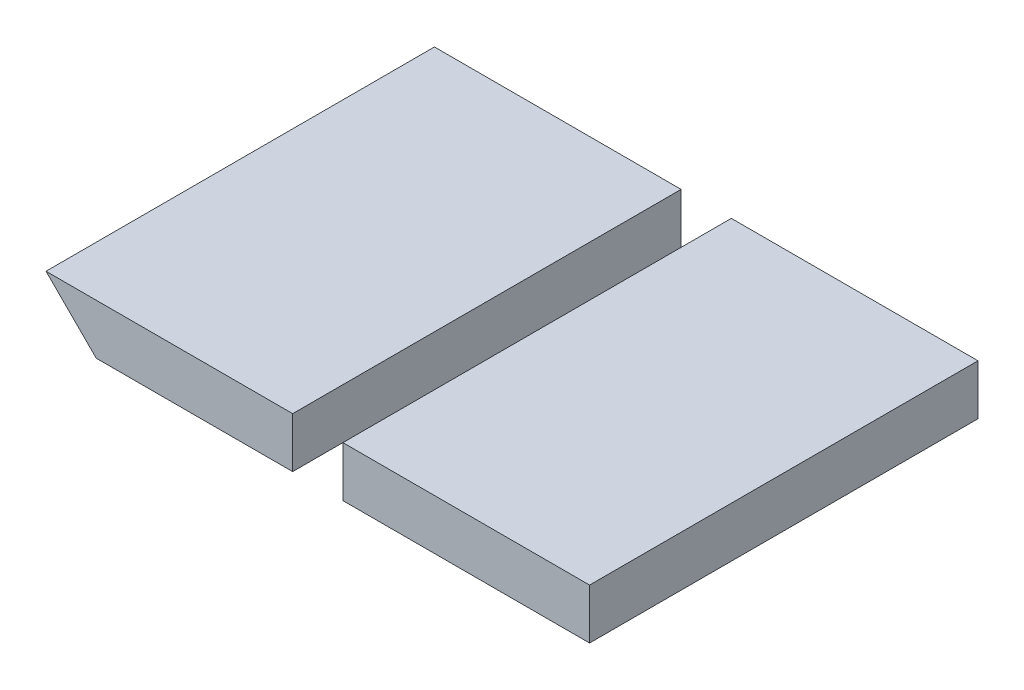
from build123d import *

# Parameters (mm, degrees)
BOSS_EXTRUDE1_DEPTH   = 20
SKETCH1_W             = 12.7
SKETCH1_H             = 2.5861
BOSS_EXTRUDE1_2_DEPTH = 20


with BuildPart() as part:
    # Sketch1 → Boss-Extrude1 (new body)
    with BuildSketch(Plane.XY):
        Polygon((-8.9361, 21.6361), (-21.6361, 21.6361), (-19.05, 19.05), (-8.9361, 19.05), align=None)
    extrude(amount=BOSS_EXTRUDE1_DEPTH)


with BuildPart() as body_2:
    # Sketch1 → Boss-Extrude1 2 (new body)
    with BuildSketch(Plane.XY):
        with Locations((0, 20.34305)):
            Rectangle(SKETCH1_W, SKETCH1_H)
    extrude(amount=BOSS_EXTRUDE1_2_DEPTH)


solid = Compound([part.part, body_2.part])
